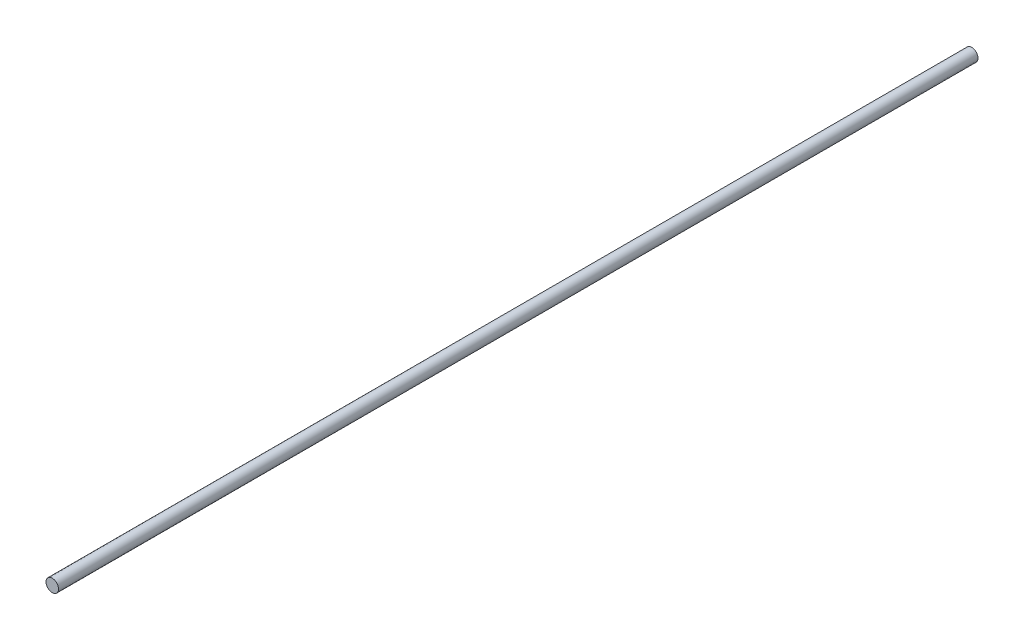
from build123d import *

# Parameters (mm, degrees)
ESQUISSE1_R        = 3
BOSS_EXTRU_1_DEPTH = 440


with BuildPart() as part:
    # Esquisse1 → Boss.-Extru.1 (new body)
    with BuildSketch(Plane.XY):
        Circle(ESQUISSE1_R)
    extrude(amount=BOSS_EXTRU_1_DEPTH)


solid = part.part
